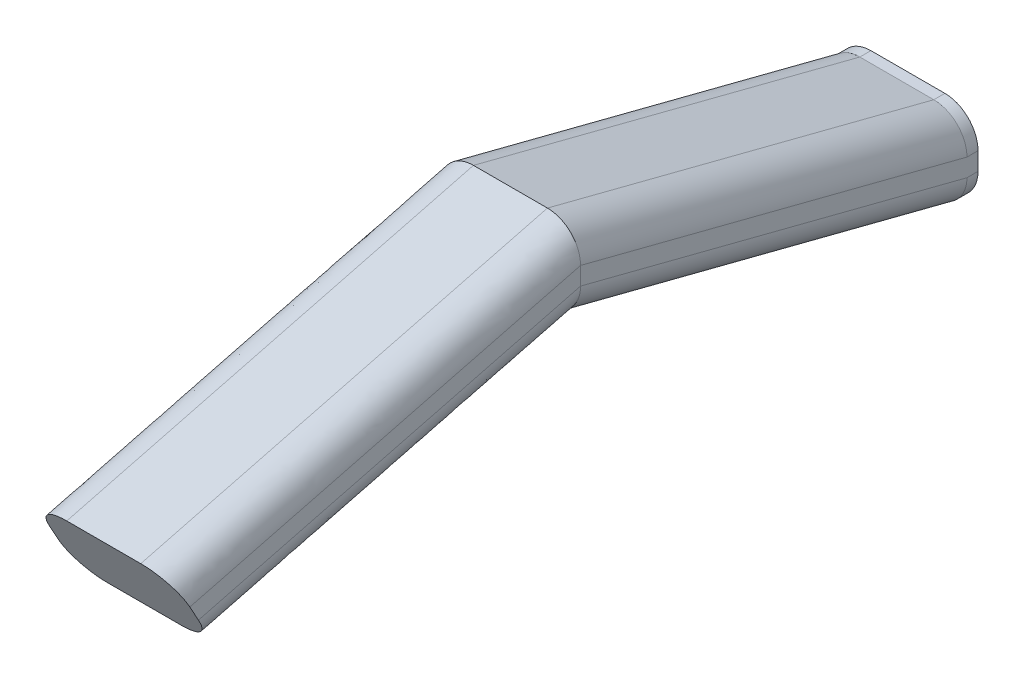
from build123d import *

# Parameters (mm, degrees)
SALIENTE_EXTRUIR1_DEPTH = 10


with BuildPart() as part:
    # Croquis1 → Saliente-Extruir1 (new body)
    with BuildSketch(Plane.XY):
        with BuildLine():
            Line((-33.5, -38.1), (33.5, -38.1))
            ThreePointArc((33.5, -38.1), (54.713203436, -29.313203436), (63.5, -8.1))
            Line((63.5, -8.1), (63.5, 8.1))
            ThreePointArc((63.5, 8.1), (54.713203436, 29.313203436), (33.5, 38.1))
            Line((33.5, 38.1), (-33.5, 38.1))
            ThreePointArc((-33.5, 38.1), (-54.713203436, 29.313203436), (-63.5, 8.1))
            Line((-63.5, 8.1), (-63.5, -8.1))
            ThreePointArc((-63.5, -8.1), (-54.713203436, -29.313203436), (-33.5, -38.1))
        make_face()
    extrude(amount=SALIENTE_EXTRUIR1_DEPTH)

    # Barrer1: sweep along a curve in space
    with BuildLine() as barrer1_path:
        Line((0, 90, 360), (0, 0, 10))
        Line((0, 90, 360), (0, 0, 710))
    # Croquis3 → Barrer1 (sweep)
    with BuildSketch(Plane.XY.offset(10)):
        with BuildLine():
            Line((33.5, -38.1), (-33.5, -38.1))
            ThreePointArc((-33.5, -38.1), (-54.713203436, -29.313203436), (-63.5, -8.1))
            Line((-63.5, -8.1), (-63.5, 8.1))
            ThreePointArc((-63.5, 8.1), (-54.713203436, 29.313203436), (-33.5, 38.1))
            Line((-33.5, 38.1), (33.5, 38.1))
            ThreePointArc((33.5, 38.1), (54.713203436, 29.313203436), (63.5, 8.1))
            Line((63.5, 8.1), (63.5, -8.1))
            ThreePointArc((63.5, -8.1), (54.713203436, -29.313203436), (33.5, -38.1))
        make_face()
    sweep(path=barrer1_path.line, transition=Transition.RIGHT)


solid = part.part
